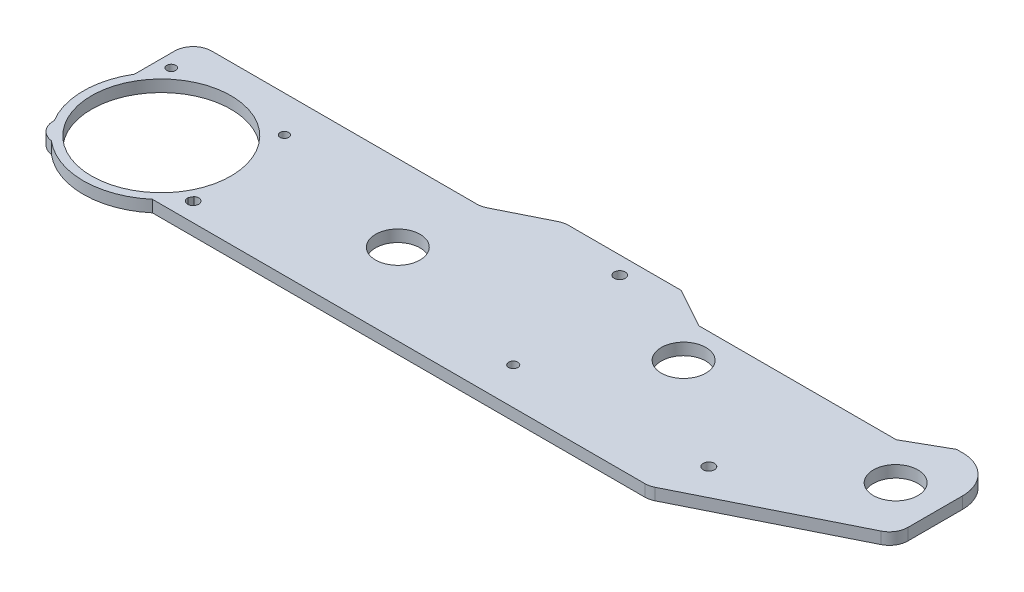
from build123d import *

# Parameters (mm, degrees)
SKETCH1_W           = 210
SKETCH1_H           = 50
SKETCH1_R           = 1.211665018
SKETCH1_R_2         = 1.165617118
SKETCH1_R_3         = 1.5
SKETCH1_R_4         = 1.25
SKETCH1_R_5         = 1.517273905
BOSS_EXTRUDE1_DEPTH = 3.175
SKETCH2_R           = 2
CUT_EXTRUDE1_DEPTH  = 10
SKETCH3_R           = 6
SKETCH3_R_2         = 0.586995366
CUT_EXTRUDE2_DEPTH  = 57.15
CUT_EXTRUDE7_DEPTH  = 10
FILLET3_R           = 5
SKETCH11_R          = 21
SKETCH11_R_2        = 2
BOSS_EXTRUDE4_DEPTH = 3.175
SKETCH12_R          = 18.78
CUT_EXTRUDE8_DEPTH  = 10
FILLET4_R           = 10


with BuildPart() as part:
    # Sketch1 → Boss-Extrude1 (new body)
    with BuildSketch(Plane(origin=(0, 0, 0), x_dir=(1, 0, 0), z_dir=(0, 1, 0))):
        with Locations((105, -25)):
            Rectangle(SKETCH1_W, SKETCH1_H)
        with Locations(Location((3.489526233, -16.787661112, 0), (0, 0, 270))):
            Circle(SKETCH1_R, mode=Mode.SUBTRACT)
        with Locations(Location((34.37258772, -17.194005245, 0), (0, 0, 270))):
            Circle(SKETCH1_R_2, mode=Mode.SUBTRACT)
        with Locations(Location((37.520749958, -44.921198121, 0), (0, 0, 270))):
            Circle(SKETCH1_R_3, mode=Mode.SUBTRACT)
        with Locations(Location((118.879039361, -40.017685043, 0), (0, 0, 270))):
            Circle(SKETCH1_R_4, mode=Mode.SUBTRACT)
        with Locations(Location((112.302052499, -4.739260115, 0), (0, 0, 270))):
            Circle(SKETCH1_R_3, mode=Mode.SUBTRACT)
        with Locations(Location((168.975233936, -37.403209633, 0), (0, 0, 270))):
            Circle(SKETCH1_R_5, mode=Mode.SUBTRACT)
    extrude(amount=BOSS_EXTRUDE1_DEPTH)

    # Sketch2 → Cut-Extrude1 (cut)
    with BuildSketch(Plane(origin=(0, 3.175, 0), x_dir=(1, 0, 0), z_dir=(0, 1, 0))):
        with Locations(Location((10, -26, 0), (0, 0, 270))):
            Circle(SKETCH2_R)
        with Locations(Location((10, -42, 0), (0, 0, 270))):
            Circle(SKETCH2_R)
        with Locations(Location((26, -26, 0), (0, 0, 270))):
            Circle(SKETCH2_R)
        with Locations(Location((26, -42, 0), (0, 0, 270))):
            Circle(SKETCH2_R)
    extrude(amount=-CUT_EXTRUDE1_DEPTH, mode=Mode.SUBTRACT)

    # Sketch3 → Cut-Extrude2 (cut)
    with BuildSketch(Plane(origin=(0, 3.175, 0), x_dir=(1, 0, 0), z_dir=(0, 1, 0))):
        with Locations(Location((75.84991357, -28.1, 0), (0, 0, 270))):
            Circle(SKETCH3_R)
        with Locations(Location((140.771956051, -16, 0), (0, 0, 270))):
            Circle(SKETCH3_R)
        with Locations(Location((18, -34, 0), (0, 0, 270))):
            Circle(SKETCH3_R_2)
        with Locations(Location((197.921956051, -16, 0), (0, 0, 270))):
            Circle(SKETCH3_R)
    extrude(amount=-CUT_EXTRUDE2_DEPTH, mode=Mode.SUBTRACT)

    # Sketch10 → Cut-Extrude7 (cut)
    with BuildSketch(Plane(origin=(0, 3.175, 0), x_dir=(1, 0, 0), z_dir=(0, 1, 0))):
        Polygon((210, -27.859435908), (165.502877994, -50), (210, -50), align=None)
        Polygon((92.532613397, 0), (77.65477062, -7.402812063), (0, -7.402812063), (0, 0), align=None)
        Polygon((124.109963401, 0), (134.770313295, -5.880313872), (187.967697751, -5.880313872), (198.343585303, 0), align=None)
    extrude(amount=-CUT_EXTRUDE7_DEPTH, mode=Mode.SUBTRACT)

    # Fillet3
    fillet3_edges = [part.edges().sort_by_distance(p)[0] for p in [
        (0, 1.5875, 7.402812063),
        (0, 1.5875, 50),
        (92.532613397, 1.5875, 0),
        (210, 1.5875, 27.859435908),
        (165.502877994, 1.5875, 50),
        (77.65477062, 1.5875, 7.402812063),
    ]]
    fillet(fillet3_edges, radius=FILLET3_R)

    # Sketch11 → Boss-Extrude4 (add)
    with BuildSketch(Plane(origin=(0, 3.175, 0), x_dir=(1, 0, 0), z_dir=(0, 1, 0))):
        with Locations((18, -34)):
            Circle(SKETCH11_R)
        with Locations(Location((10, -26, 0), (0, 0, 270))):
            Circle(SKETCH11_R_2, mode=Mode.SUBTRACT)
        with Locations(Location((10, -42, 0), (0, 0, 270))):
            Circle(SKETCH11_R_2, mode=Mode.SUBTRACT)
        with Locations(Location((26, -26, 0), (0, 0, 270))):
            Circle(SKETCH11_R_2, mode=Mode.SUBTRACT)
        with Locations(Location((26, -42, 0), (0, 0, 270))):
            Circle(SKETCH11_R_2, mode=Mode.SUBTRACT)
    extrude(amount=-BOSS_EXTRUDE4_DEPTH)

    # Sketch12 → Cut-Extrude8 (cut)
    with BuildSketch(Plane(origin=(0, 3.175, 0), x_dir=(1, 0, 0), z_dir=(0, 1, 0))):
        with Locations(Location((18, -34, 0), (0, 0, 270))):
            Circle(SKETCH12_R)
    extrude(amount=-CUT_EXTRUDE8_DEPTH, mode=Mode.SUBTRACT)

    # Fillet4
    fillet4_edges = [part.edges().sort_by_distance(p)[0] for p in [
        (210, 1.5875, 0),
    ]]
    fillet(fillet4_edges, radius=FILLET4_R)


solid = part.part
